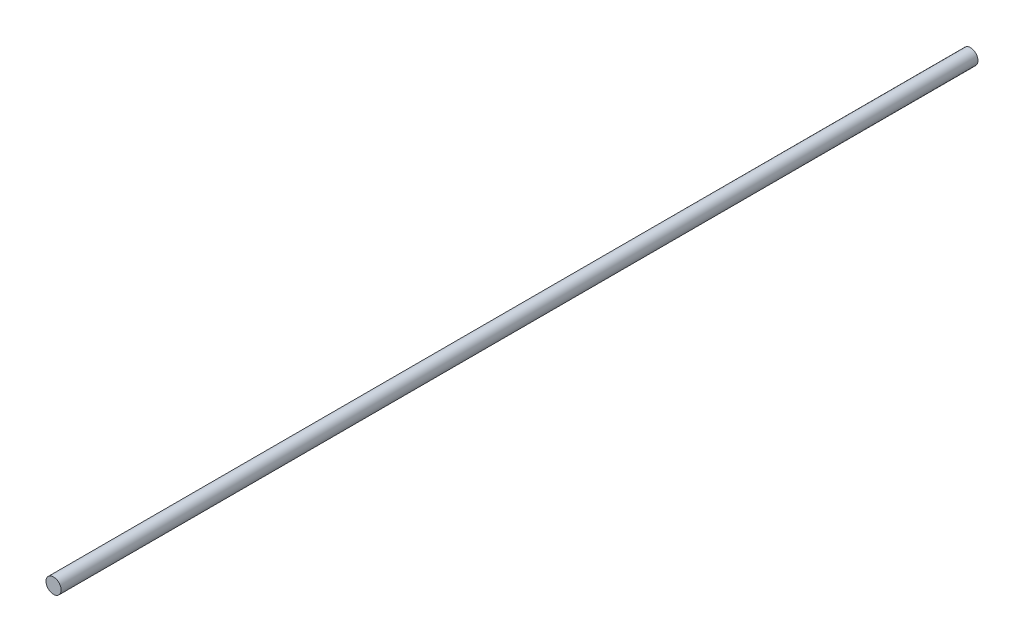
from build123d import *

# Parameters (mm, degrees)
SKETCH1_R           = 4
BOSS_EXTRUDE1_DEPTH = 485


with BuildPart() as part:
    # Sketch1 → Boss-Extrude1 (new body)
    with BuildSketch(Plane.XY):
        Circle(SKETCH1_R)
    extrude(amount=BOSS_EXTRUDE1_DEPTH)


solid = part.part
